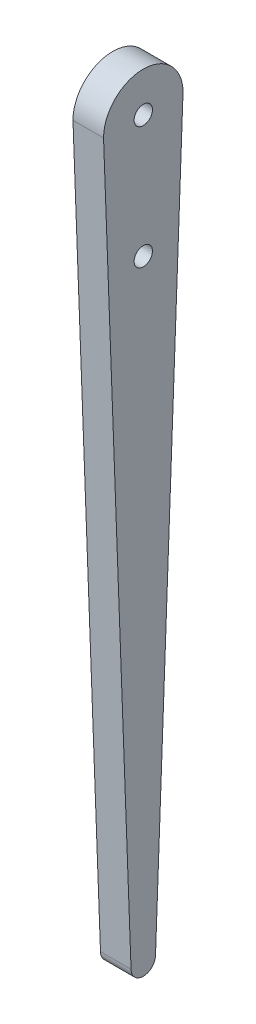
from build123d import *

# Parameters (mm, degrees)
SKETCH1_R           = 1.5
BOSS_EXTRUDE1_DEPTH = 5


with BuildPart() as part:
    # Sketch1 → Boss-Extrude1 (new body)
    with BuildSketch(Plane(origin=(0, 0, 0), x_dir=(0, 0, -1), z_dir=(1, 0, 0))):
        with BuildLine():
            Line((-6.5, 60), (-2, -60))
            ThreePointArc((-2, -60), (0, -62), (2, -60))
            Line((2, -60), (6.5, 60))
            ThreePointArc((6.5, 60), (0, 66.5), (-6.5, 60))
        make_face()
        with Locations((0, 60)):
            Circle(SKETCH1_R, mode=Mode.SUBTRACT)
        with Locations((0, 40)):
            Circle(SKETCH1_R, mode=Mode.SUBTRACT)
    extrude(amount=BOSS_EXTRUDE1_DEPTH)


solid = part.part
